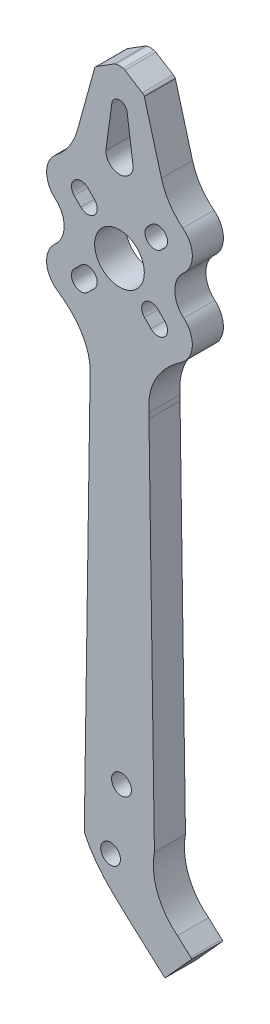
from build123d import *

# Parameters (mm, degrees)
CROQUIS1_R              = 1.59
CROQUIS1_R_2            = 1.597396507
CROQUIS1_R_3            = 4
SALIENTE_EXTRUIR1_DEPTH = 5


with BuildPart() as part:
    # Croquis1 → Saliente-Extruir1 (new body)
    with BuildSketch(Plane.XY):
        with BuildLine():
            ThreePointArc((0.575431621, 26.806598054), (0.289790201, 26.858453505), (0, 26.875821538))
            ThreePointArc((0, 26.875821538), (-0.289790201, 26.858453505), (-0.575431621, 26.806598054))
            ThreePointArc((-0.575431621, 26.806598054), (-0.726756088, 26.756581913), (-0.868212659, 26.683160203))
            Line((-0.868212659, 26.683160203), (-3.655582472, 24.941297878))
            ThreePointArc((-3.655582472, 24.941297878), (-3.850805823, 24.781837219), (-3.999952041, 24.578624857))
            Line((-3.999952041, 24.578624857), (-6.759600821, 14.534111339))
            ThreePointArc((-6.759600821, 14.534111339), (-8.069386565, 11.655007451), (-10.212860864, 9.329003191))
            Line((-10.212860864, 9.329003191), (-10.213051715, 9.328852796))
            ThreePointArc((-10.213051715, 9.328852796), (-11.736097249, 6.280434064), (-10.356800654, 3.164336284))
            ThreePointArc((-10.356800654, 3.164336284), (-8.911806366, 0), (-10.356800654, -3.164336284))
            ThreePointArc((-10.356800654, -3.164336284), (-11.730778796, -6.413465762), (-9.998574535, -9.48659555))
            add(Edge.make_bspline(
                [(-4.75, -19.102398031), (-4.354825004, -14.738479929), (-6.980177997, -11.541798515), (-9.998574535, -9.48659555)],
                knots=[0, 0, 0, 0, 1, 1, 1, 1], degree=3))
            Line((-4.75, -19.102398031), (-4.75, -20))
            Line((-4.75, -20), (-5.626230736, -80))
            Line((-5.626230736, -80), (-5.626230736, -82.958659211))
            add(Edge.make_bspline(
                [(-5.626230736, -82.958659211), (-3.957996586, -86.469029482), (-1.413273472, -88.8202413), (1.317079372, -91.291125809)],
                knots=[0, 0, 0, 0, 0.775055833, 0.775055833, 0.775055833, 0.775055833], degree=3))
            Line((1.317079372, -91.291125809), (7.31863448, -96.699816586))
            Line((7.31863448, -96.699816586), (11.655892242, -91.88713778))
            Line((11.655892242, -91.88713778), (11.488752063, -91.736508564))
            Line((11.488752063, -91.736508564), (9.346047089, -89.776810767))
            ThreePointArc((9.346047089, -89.776810767), (6.105829013, -85.413576573), (5.626230736, -80))
            Line((5.626230736, -80), (4.75, -20))
            Line((4.75, -20), (4.75, -19.102398031))
            add(Edge.make_bspline(
                [(4.75, -19.102398031), (4.354825004, -14.738479929), (6.980177997, -11.541798515), (9.998574535, -9.48659555)],
                knots=[0, 0, 0, 0, 1, 1, 1, 1], degree=3))
            ThreePointArc((9.998574535, -9.48659555), (11.730778796, -6.413465762), (10.356800654, -3.164336284))
            ThreePointArc((10.356800654, -3.164336284), (8.911806366, 0), (10.356800654, 3.164336284))
            ThreePointArc((10.356800654, 3.164336284), (11.736094415, 6.280555524), (10.212860864, 9.329003191))
            ThreePointArc((10.212860864, 9.329003191), (8.069386565, 11.655007451), (6.759600821, 14.534111339))
            Line((6.759600821, 14.534111339), (3.999952041, 24.578624857))
            ThreePointArc((3.999952041, 24.578624857), (3.850805823, 24.781837219), (3.655582472, 24.941297878))
            Line((3.655582472, 24.941297878), (0.868212659, 26.683160203))
            ThreePointArc((0.868212659, 26.683160203), (0.726756088, 26.756581913), (0.575431621, 26.806598054))
        make_face()
        with Locations((-1.433916555, -83.744346036)):
            Circle(CROQUIS1_R, mode=Mode.SUBTRACT)
        with Locations((0.324013646, -73.204752137)):
            Circle(CROQUIS1_R_2, mode=Mode.SUBTRACT)
        with BuildLine():
            ThreePointArc((-5.091168825, -7.283199846), (-7.283199846, -7.283199846), (-7.283199846, -5.091168825))
            Line((-7.283199846, -5.091168825), (-6.222539674, -4.030508653))
            ThreePointArc((-6.222539674, -4.030508653), (-4.030508653, -4.030508653), (-4.030508653, -6.222539674))
            Line((-4.030508653, -6.222539674), (-5.091168825, -7.283199846))
        make_face(mode=Mode.SUBTRACT)
        with BuildLine():
            ThreePointArc((-7.283199846, 5.091168825), (-7.283199846, 7.283199846), (-5.091168825, 7.283199846))
            Line((-5.091168825, 7.283199846), (-4.030508653, 6.222539674))
            ThreePointArc((-4.030508653, 6.222539674), (-4.030508653, 4.030508653), (-6.222539674, 4.030508653))
            Line((-6.222539674, 4.030508653), (-7.283199846, 5.091168825))
        make_face(mode=Mode.SUBTRACT)
        with BuildLine():
            ThreePointArc((7.283199846, -5.091168825), (7.283199846, -7.283199846), (5.091168825, -7.283199846))
            Line((5.091168825, -7.283199846), (4.030508653, -6.222539674))
            ThreePointArc((4.030508653, -6.222539674), (4.030508653, -4.030508653), (6.222539674, -4.030508653))
            Line((6.222539674, -4.030508653), (7.283199846, -5.091168825))
        make_face(mode=Mode.SUBTRACT)
        Circle(CROQUIS1_R_3, mode=Mode.SUBTRACT)
        with BuildLine():
            Line((4.560838717, 6.752869739), (5.091168825, 7.283199846))
            ThreePointArc((5.091168825, 7.283199846), (7.283199846, 7.283199846), (7.283199846, 5.091168825))
            Line((7.283199846, 5.091168825), (6.574607513, 4.382576491))
            ThreePointArc((6.574607513, 4.382576491), (6.567912728, 4.390303583), (6.561246717, 4.398055511))
            ThreePointArc((6.561246717, 4.398055511), (4.475555235, 4.653344091), (4.560838717, 6.752869739))
        make_face(mode=Mode.SUBTRACT)
        with BuildLine():
            ThreePointArc((2.197784017, 13.915961953), (0, 11.718177935), (-2.197784017, 13.915961953))
            Line((-2.197784017, 13.915961953), (-1.25, 20.851501258))
            ThreePointArc((-1.25, 20.851501258), (-0.883883476, 21.735384735), (0, 22.101501258))
            ThreePointArc((0, 22.101501258), (0.883883476, 21.735384735), (1.25, 20.851501258))
            Line((1.25, 20.851501258), (2.197784017, 13.915961953))
        make_face(mode=Mode.SUBTRACT)
    extrude(amount=SALIENTE_EXTRUIR1_DEPTH)


solid = part.part
